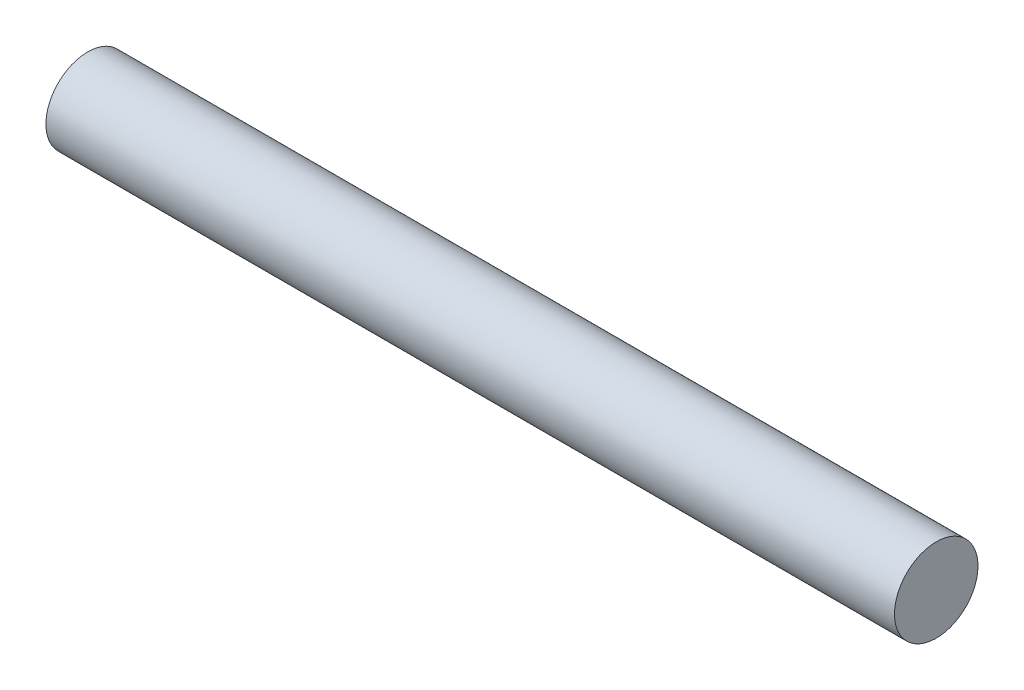
from build123d import *

# Parameters (mm, degrees)
SKETCH1_R           = 2.5
BOSS_EXTRUDE1_DEPTH = 50.8


with BuildPart() as part:
    # Sketch1 → Boss-Extrude1 (new body)
    with BuildSketch(Plane(origin=(0, 0, 0), x_dir=(0, 0, -1), z_dir=(1, 0, 0))):
        Circle(SKETCH1_R)
    extrude(amount=BOSS_EXTRUDE1_DEPTH)


solid = part.part
